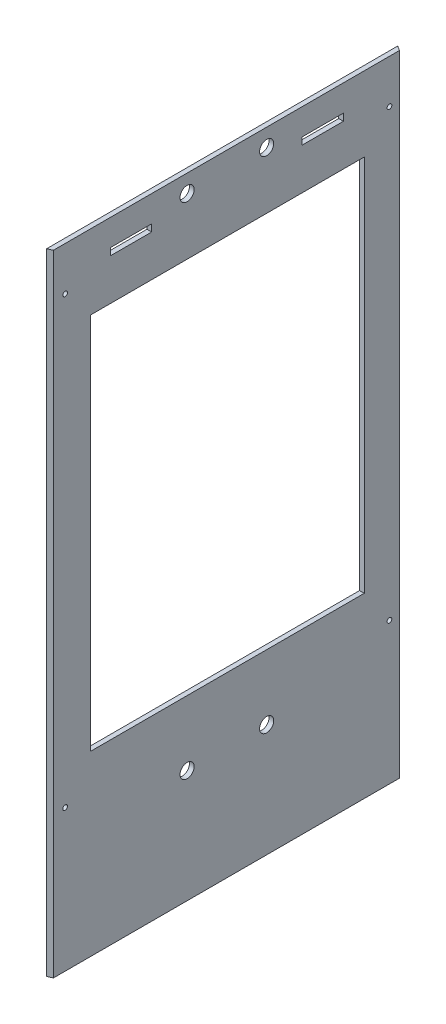
from build123d import *

# Parameters (mm, degrees)
EXTRUDE_1_DEPTH    = 533.713673317
SKETCH1_W          = 232
SKETCH1_H          = 320
CUT_EXTRUDE1_DEPTH = 611.987450173
SKETCH2_W          = 35
SKETCH2_H          = 6
CUT_EXTRUDE2_DEPTH = 611.987450173
SKETCH3_R          = 6
CUT_EXTRUDE3_DEPTH = 611.987450173
SKETCH4_R          = 2
CUT_EXTRUDE4_DEPTH = 611.987450173


with BuildPart() as part:
    # Эскиз1 → Вытянуть1 (new body)
    with BuildSketch(Plane(origin=(0, 0, 0), x_dir=(1, 0, 0), z_dir=(0, 1, 0))):
        Polygon((0, 0), (4, 1.764508657), (4, 294.827324918), (0, 297.387590837), align=None)
    extrude(amount=EXTRUDE_1_DEPTH)

    # Sketch1 → Cut-Extrude1 (cut, through all)
    with BuildSketch(Plane.ZY):
        with Locations((-149.055893529, 310.5)):
            Rectangle(SKETCH1_W, SKETCH1_H)
    extrude(amount=-CUT_EXTRUDE1_DEPTH, mode=Mode.SUBTRACT)

    # Sketch2 → Cut-Extrude2 (cut, through all)
    with BuildSketch(Plane.ZY):
        with Locations((-229.887590837, 508.5)):
            Rectangle(SKETCH2_W, SKETCH2_H)
        with Locations((-67.5, 508.5)):
            Rectangle(SKETCH2_W, SKETCH2_H)
    extrude(amount=-CUT_EXTRUDE2_DEPTH, mode=Mode.SUBTRACT)

    # Sketch3 → Cut-Extrude3 (cut, through all)
    with BuildSketch(Plane.ZY):
        with Locations((-182.387590837, 518.713673317)):
            Circle(SKETCH3_R)
        with Locations((-115, 518.713673317)):
            Circle(SKETCH3_R)
        with Locations((-182.387590837, 95.5)):
            Circle(SKETCH3_R)
        with Locations((-115, 95.5)):
            Circle(SKETCH3_R)
    extrude(amount=-CUT_EXTRUDE3_DEPTH, mode=Mode.SUBTRACT)

    # Sketch4 → Cut-Extrude4 (cut, through all)
    with BuildSketch(Plane.ZY):
        with Locations((-286.387590837, 496.713673317)):
            Circle(SKETCH4_R)
        with Locations(Location((-11.724196221, 496.713673317, 0), (0, 0, 180))):
            Circle(SKETCH4_R)
        with Locations((-286.387590837, 120)):
            Circle(SKETCH4_R)
        with Locations(Location((-11.724196221, 120, 0), (0, 0, 180))):
            Circle(SKETCH4_R)
    extrude(amount=-CUT_EXTRUDE4_DEPTH, mode=Mode.SUBTRACT)


solid = part.part
